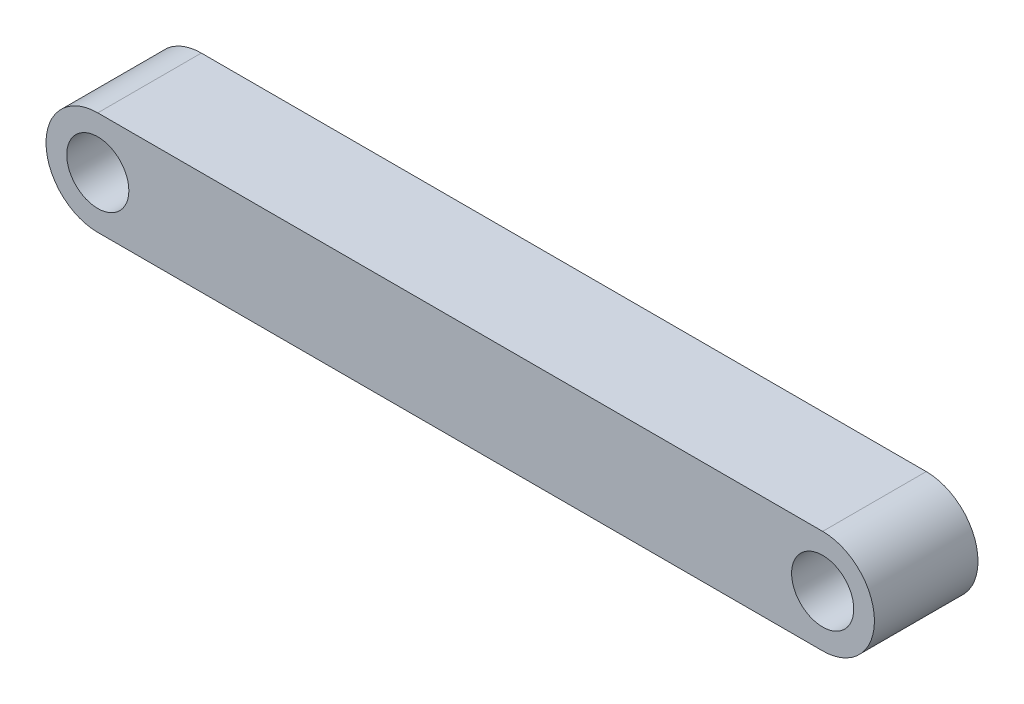
from build123d import *

# Parameters (mm, degrees)
BOSS_EXTRUDE1_DEPTH = 20
SKETCH2_R           = 6
CUT_EXTRUDE1_DEPTH  = 84.066238629


with BuildPart() as part:
    # Sketch1 → Boss-Extrude1 (new body)
    with BuildSketch(Plane.XY):
        with BuildLine():
            Line((70, -10), (-70, -10))
            ThreePointArc((-70, -10), (-80, 0), (-70, 10))
            Line((-70, 10), (70, 10))
            ThreePointArc((70, 10), (80, 0), (70, -10))
        make_face()
    extrude(amount=BOSS_EXTRUDE1_DEPTH)

    # Sketch2 → Cut-Extrude1 (cut, through all)
    with BuildSketch(Plane.XY.offset(20)):
        with Locations((-70, 0)):
            Circle(SKETCH2_R)
        with Locations((70, 0)):
            Circle(SKETCH2_R)
    extrude(amount=-CUT_EXTRUDE1_DEPTH, mode=Mode.SUBTRACT)


solid = part.part
